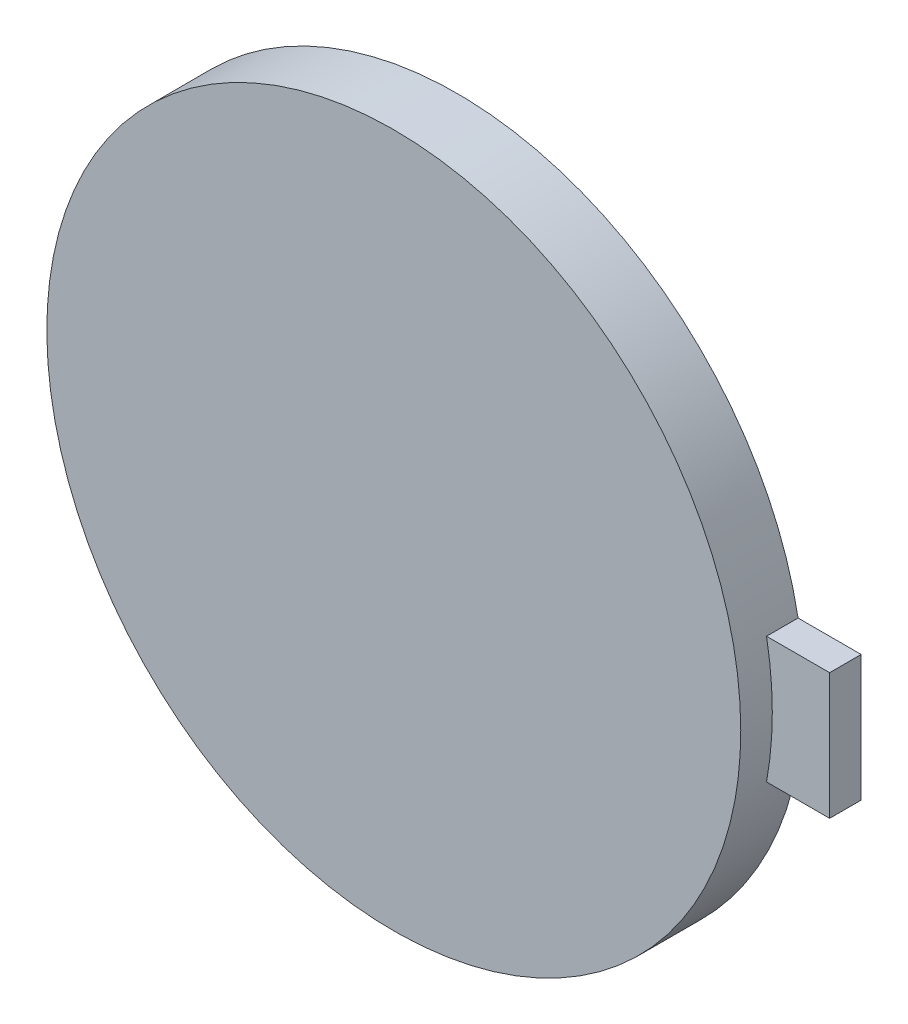
from build123d import *

# Parameters (mm, degrees)
SKETCH_1_R          = 55
SKETCH_1_R_2        = 50
EXTRUDE_1_DEPTH     = 5
SKETCH_3_R          = 55
EXTRUDE_2_DEPTH     = 5
SKETCH_5_W          = 10
SKETCH_5_H          = 20
EXTRUDE_3_DEPTH     = 10
CUT_EXTRUDE_START   = -5
CUT_EXTRUDE_1_DEPTH = 5


with BuildPart() as part:
    # 스케치1 → 보스-돌출1 (new body)
    with BuildSketch(Plane.XY):
        Circle(SKETCH_1_R)
        Circle(SKETCH_1_R_2, mode=Mode.SUBTRACT)
    extrude(amount=EXTRUDE_1_DEPTH)

    # 스케치3 → 보스-돌출2 (add)
    with BuildSketch(Plane.XY.offset(5)):
        Circle(SKETCH_3_R)
    extrude(amount=EXTRUDE_2_DEPTH)

    # 스케치5 → 보스-돌출3 (add)
    with BuildSketch(Plane.XY):
        with Locations((59.083269132, 0)):
            Rectangle(SKETCH_5_W, SKETCH_5_H)
    extrude(amount=EXTRUDE_3_DEPTH)

    # 스케치6 → 컷-돌출1 (cut)
    with BuildSketch(Plane.XY.offset(10).offset(CUT_EXTRUDE_START)):
        with BuildLine():
            Line((54.083269132, 10), (64.083269132, 10))
            Line((64.083269132, 10), (64.083269132, -10))
            Line((64.083269132, -10), (54.083269132, -10))
            ThreePointArc((54.083269132, -10), (55, 0), (54.083269132, 10))
        make_face()
    extrude(amount=CUT_EXTRUDE_1_DEPTH, mode=Mode.SUBTRACT)


solid = part.part
